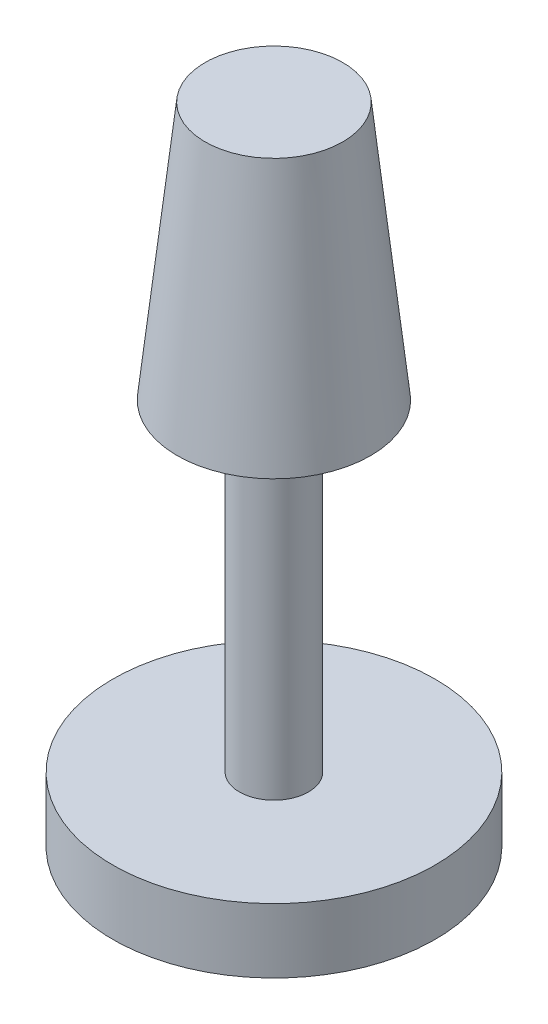
from build123d import *

# Parameters (mm, degrees)
SKETCH3_W = 5
SKETCH3_H = 2


with BuildPart() as part:
    # Sketch1 → Revolve2 (revolve)
    with BuildSketch(Plane.XY):
        Polygon((0, -8.647232081), (0, 11.352767919), (2.135, 11.352767919), (3, 3.352767919), (1.071676077, 3.352767919), (1.071676077, -8.647232081), align=None)
    revolve(axis=Axis((0, -8.647232081, 0), (0, 1, 0)))

    # Sketch3 → Revolve3 (revolve)
    with BuildSketch(Plane.XY):
        with Locations((2.5, -7.647232081)):
            Rectangle(SKETCH3_W, SKETCH3_H)
    revolve(axis=Axis((0, -8.647232081, 0), (0, 1, 0)))


solid = part.part
